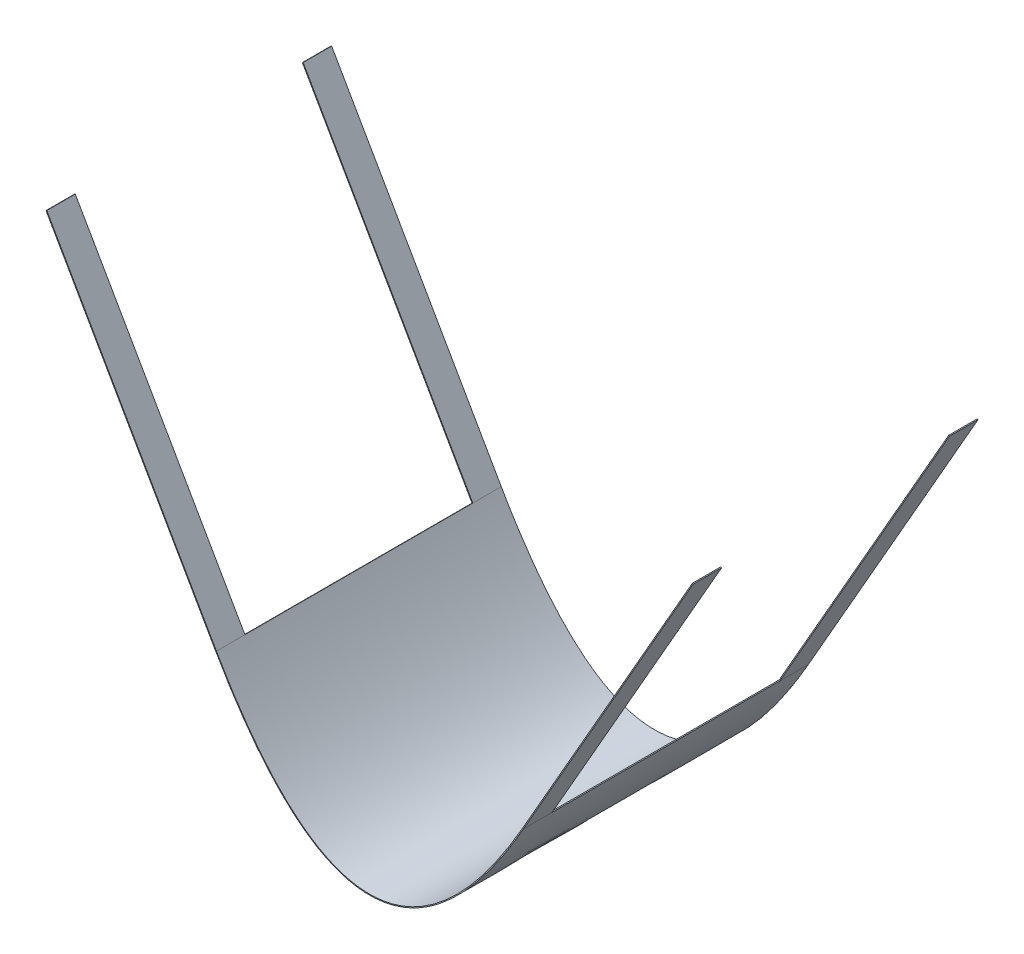
from build123d import *

# Parameters (mm, degrees)
SHEET_DEPTH             = 125
SKETCH2_W               = 0.79375
SKETCH2_H               = 25
LEGS_DEPTH              = 300
MIRROR2_COPY_1_SKETCH_W = 0.79375
MIRROR2_COPY_1_SKETCH_H = 25
MIRROR2_COPY_1_DEPTH    = 300


with BuildPart() as part:
    # Sketch1 → Sheet (new, symmetric)
    with BuildSketch(Plane.XY):
        with BuildLine():
            Line((-135.121238085, 117.193313767), (-134.432129079, 117.58722726))
            add(Edge.make_bspline(
                [(-134.432129079, 117.58722726), (0, -117.58722726), (134.432129079, 117.58722726)],
                knots=[0, 0, 0, 1, 1, 1], degree=2))
            Line((134.432129079, 117.58722726), (135.121238085, 117.193313767))
            add(Edge.make_bspline(
                [(-135.121238085, 117.193313767), (-109.888419219, 73.043874291), (-67.750885521, 26.96498113), (-33.942971604, 4.776889751), (0, -2.650629917), (33.942971604, 4.776889751), (67.750885521, 26.96498113), (109.888419219, 73.043874291), (135.121238085, 117.193313767)],
                knots=[0, 0, 0, 0.1875, 0.3125, 0.4375, 0.5625, 0.6875, 0.8125, 1, 1, 1], degree=2))
        make_face()
    extrude(amount=SHEET_DEPTH, both=True)

    # Sketch2 → Legs (add)
    with BuildSketch(Plane(origin=(-83.770231055, 146.546949218, 0), x_dir=(0.8681688267207968, 0.4962689677082734, 0), z_dir=(-0.4962689677082734, 0.8681688267207968, 0))):
        with Locations((-58.751766888, 112.5)):
            Rectangle(SKETCH2_W, SKETCH2_H)
    legs = extrude(amount=LEGS_DEPTH)

    # Mirror1: Legs across plane
    add(legs.mirror(Plane(origin=(0, 0, 0), x_dir=(0, 0, 1), z_dir=(1, 0, 0))))

    # Mirror2: Legs across plane
    add(legs.mirror(Plane.XY))

    # Mirror2 copy 1 sketch → Mirror2 copy 1 (add)
    with BuildSketch(Plane(origin=(83.770231055, 146.546949218, 0), x_dir=(-0.8681688267207968, 0.4962689677082734, 0), z_dir=(0.4962689677082734, 0.8681688267207968, 0))):
        with Locations((-58.751766888, 112.5)):
            Rectangle(MIRROR2_COPY_1_SKETCH_W, MIRROR2_COPY_1_SKETCH_H)
    extrude(amount=MIRROR2_COPY_1_DEPTH)


solid = part.part
